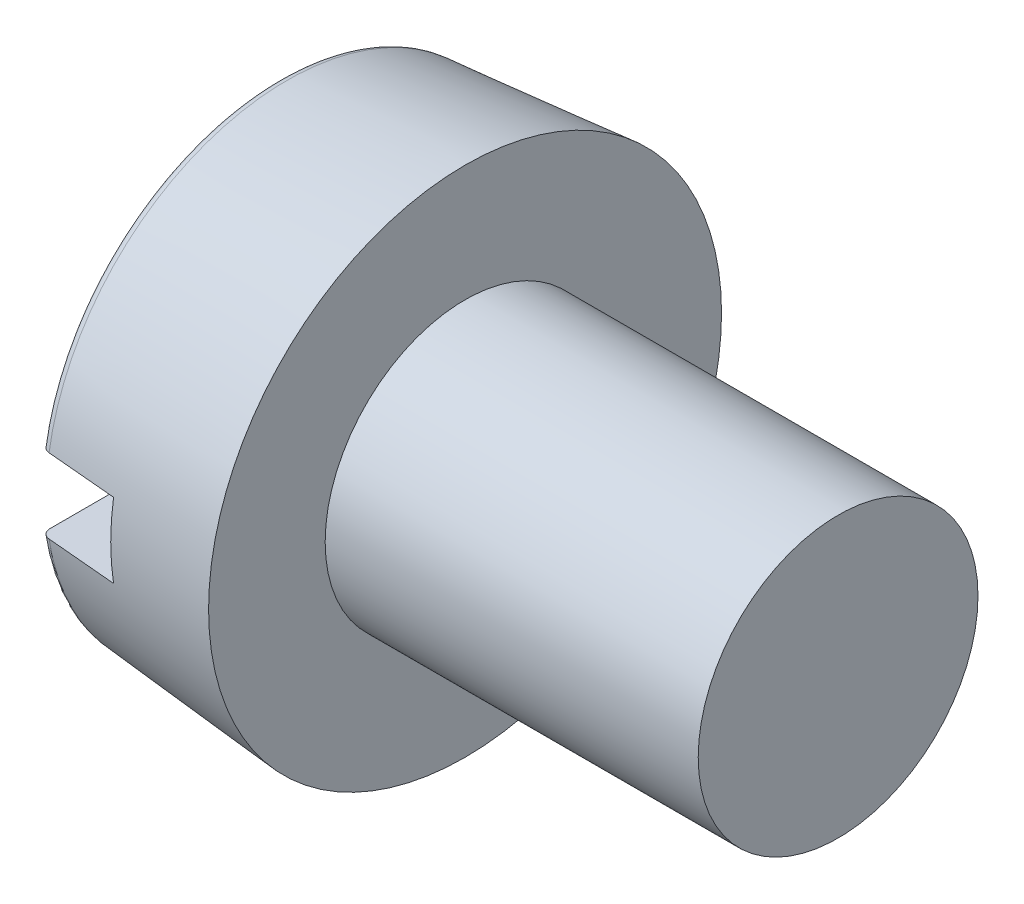
from build123d import *

# Parameters (mm, degrees)
FILLET2_R  = 0.1
SKETCH2_W  = 5.5
SKETCH2_H  = 0.8
SLOT_DEPTH = 0.85


with BuildPart() as part:
    # BodySke → Base-Revolve (revolve)
    with BuildSketch(Plane.XY, mode=Mode.PRIVATE) as base_revolve_sk:
        Polygon((2, 1.5), (2, 2.75), (0, 2.575022673), (0, 0), (6, 0), (6, 1.5), align=None)
    revolve(base_revolve_sk.sketch.rotate(Axis((-25.4, 0, 0), (1, 0, 0)), 90), axis=Axis((-25.4, 0, 0), (1, 0, 0)))

    # Fillet2
    fillet2_edges = [part.edges().sort_by_distance(p)[0] for p in [
        (0, 0, -2.575022673),
    ]]
    fillet(fillet2_edges, radius=FILLET2_R)

    # Sketch2 → Slot (cut)
    with BuildSketch(Plane(origin=(0, 0, 0), x_dir=(0, 0, -1), z_dir=(1, 0, 0))):
        Rectangle(SKETCH2_W, SKETCH2_H)
    extrude(amount=SLOT_DEPTH, mode=Mode.SUBTRACT)


solid = part.part
